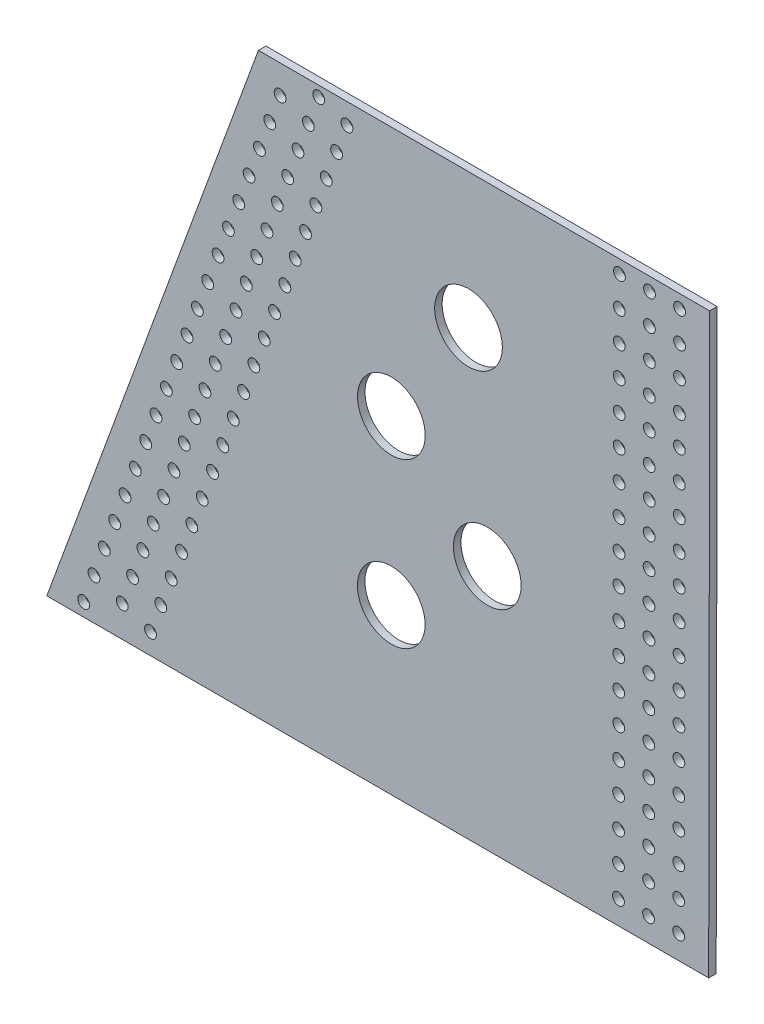
from build123d import *

# Parameters (mm, degrees)
SKETCH4_R           = 14.2875
SKETCH4_R_2         = 2.4892
SKETCH4_R_3         = 9.525
BOSS_EXTRUDE2_DEPTH = 3.175
SKETCH11_R          = 2.4892
CUT_EXTRUDE2_DEPTH  = 3.175
BOSS_EXTRUDE3_START = -3.175
SKETCH12_R          = 2.4892
SKETCH12_R_2        = 29.21
BOSS_EXTRUDE3_DEPTH = 3.175


with BuildPart() as part:
    # Sketch4 → Boss-Extrude2 (new body)
    with BuildSketch(Plane.XY):
        Polygon((93.776397203, 244.095891287), (284.276397203, 244.095891287), (283.85323076, 0), (4.45323076, 0), align=None)
        with Locations((182.46816735, 187.031911832)):
            Circle(SKETCH4_R, mode=Mode.SUBTRACT)
        with Locations((149.900784931, 138.468767486)):
            Circle(SKETCH4_R, mode=Mode.SUBTRACT)
        with Locations((134.00552713, 158.435496689)):
            Circle(SKETCH4_R_2, mode=Mode.SUBTRACT)
        with Locations((165.694943773, 118.731329743)):
            Circle(SKETCH4_R_2, mode=Mode.SUBTRACT)
        with Locations((190.39276448, 103.84941923)):
            Circle(SKETCH4_R, mode=Mode.SUBTRACT)
        with Locations((149.858385304, 69.329241783)):
            Circle(SKETCH4_R, mode=Mode.SUBTRACT)
        with Locations((197.368237983, 18.743845986)):
            Circle(SKETCH4_R_2, mode=Mode.SUBTRACT)
        with Locations((115.072237983, 40.740891242)):
            Circle(SKETCH4_R_3, mode=Mode.SUBTRACT)
        with Locations((184.668237983, 40.740891242)):
            Circle(SKETCH4_R_3, mode=Mode.SUBTRACT)
        with Locations((210.068237983, 40.740891242)):
            Circle(SKETCH4_R_2, mode=Mode.SUBTRACT)
        with Locations((171.968237983, 18.743845986)):
            Circle(SKETCH4_R_2, mode=Mode.SUBTRACT)
        with Locations((159.268237983, 40.740891242)):
            Circle(SKETCH4_R_2, mode=Mode.SUBTRACT)
        with Locations((171.968237983, 62.737936498)):
            Circle(SKETCH4_R_2, mode=Mode.SUBTRACT)
        with Locations((197.368237983, 62.737936498)):
            Circle(SKETCH4_R_2, mode=Mode.SUBTRACT)
        with Locations((140.472237983, 40.740891242)):
            Circle(SKETCH4_R_2, mode=Mode.SUBTRACT)
        with Locations((127.772237983, 18.743845986)):
            Circle(SKETCH4_R_2, mode=Mode.SUBTRACT)
        with Locations((102.372237983, 18.743845986)):
            Circle(SKETCH4_R_2, mode=Mode.SUBTRACT)
        with Locations((89.672237983, 40.740891242)):
            Circle(SKETCH4_R_2, mode=Mode.SUBTRACT)
        with Locations((102.372237983, 62.737936498)):
            Circle(SKETCH4_R_2, mode=Mode.SUBTRACT)
        with Locations((127.772237983, 62.737936498)):
            Circle(SKETCH4_R_2, mode=Mode.SUBTRACT)
    extrude(amount=BOSS_EXTRUDE2_DEPTH)

    # Sketch11 → Cut-Extrude2 (cut)
    with BuildSketch(Plane.XY.offset(3.175)):
        with Locations((271.566690721, 238.507891287)):
            Circle(SKETCH11_R)
        with Locations((258.866690721, 238.507891287)):
            Circle(SKETCH11_R)
        with Locations((246.166690721, 238.507891287)):
            Circle(SKETCH11_R)
        with Locations((258.84467394, 225.807910372)):
            Circle(SKETCH11_R)
        with Locations((246.14467394, 225.807910372)):
            Circle(SKETCH11_R)
        with Locations((258.822657159, 213.107929456)):
            Circle(SKETCH11_R)
        with Locations((246.122657159, 213.107929456)):
            Circle(SKETCH11_R)
        with Locations((258.800640378, 200.40794854)):
            Circle(SKETCH11_R)
        with Locations((246.100640378, 200.40794854)):
            Circle(SKETCH11_R)
        with Locations((258.778623597, 187.707967624)):
            Circle(SKETCH11_R)
        with Locations((246.078623597, 187.707967624)):
            Circle(SKETCH11_R)
        with Locations((258.756606817, 175.007986708)):
            Circle(SKETCH11_R)
        with Locations((246.056606817, 175.007986708)):
            Circle(SKETCH11_R)
        with Locations((258.734590036, 162.308005793)):
            Circle(SKETCH11_R)
        with Locations((246.034590036, 162.308005793)):
            Circle(SKETCH11_R)
        with Locations((258.712573255, 149.608024877)):
            Circle(SKETCH11_R)
        with Locations((246.012573255, 149.608024877)):
            Circle(SKETCH11_R)
        with Locations((258.690556474, 136.908043961)):
            Circle(SKETCH11_R)
        with Locations((245.990556474, 136.908043961)):
            Circle(SKETCH11_R)
        with Locations((258.668539693, 124.208063045)):
            Circle(SKETCH11_R)
        with Locations((245.968539693, 124.208063045)):
            Circle(SKETCH11_R)
        with Locations((258.646522912, 111.508082129)):
            Circle(SKETCH11_R)
        with Locations((245.946522912, 111.508082129)):
            Circle(SKETCH11_R)
        with Locations((258.624506131, 98.808101214)):
            Circle(SKETCH11_R)
        with Locations((245.924506131, 98.808101214)):
            Circle(SKETCH11_R)
        with Locations((258.60248935, 86.108120298)):
            Circle(SKETCH11_R)
        with Locations((245.90248935, 86.108120298)):
            Circle(SKETCH11_R)
        with Locations((258.58047257, 73.408139382)):
            Circle(SKETCH11_R)
        with Locations((245.88047257, 73.408139382)):
            Circle(SKETCH11_R)
        with Locations((258.558455789, 60.708158466)):
            Circle(SKETCH11_R)
        with Locations((245.858455789, 60.708158466)):
            Circle(SKETCH11_R)
        with Locations((258.536439008, 48.008177551)):
            Circle(SKETCH11_R)
        with Locations((245.836439008, 48.008177551)):
            Circle(SKETCH11_R)
        with Locations((258.514422227, 35.308196635)):
            Circle(SKETCH11_R)
        with Locations((245.814422227, 35.308196635)):
            Circle(SKETCH11_R)
        with Locations((258.492405446, 22.608215719)):
            Circle(SKETCH11_R)
        with Locations((245.792405446, 22.608215719)):
            Circle(SKETCH11_R)
        with Locations((258.470388665, 9.908234803)):
            Circle(SKETCH11_R)
        with Locations((245.770388665, 9.908234803)):
            Circle(SKETCH11_R)
        with Locations((271.54467394, 225.807910372)):
            Circle(SKETCH11_R)
        with Locations((271.522657159, 213.107929456)):
            Circle(SKETCH11_R)
        with Locations((271.500640378, 200.40794854)):
            Circle(SKETCH11_R)
        with Locations((271.478623597, 187.707967624)):
            Circle(SKETCH11_R)
        with Locations((271.456606817, 175.007986708)):
            Circle(SKETCH11_R)
        with Locations((271.434590036, 162.308005793)):
            Circle(SKETCH11_R)
        with Locations((271.412573255, 149.608024877)):
            Circle(SKETCH11_R)
        with Locations((271.390556474, 136.908043961)):
            Circle(SKETCH11_R)
        with Locations((271.368539693, 124.208063045)):
            Circle(SKETCH11_R)
        with Locations((271.346522912, 111.508082129)):
            Circle(SKETCH11_R)
        with Locations((271.324506131, 98.808101214)):
            Circle(SKETCH11_R)
        with Locations((271.30248935, 86.108120298)):
            Circle(SKETCH11_R)
        with Locations((271.28047257, 73.408139382)):
            Circle(SKETCH11_R)
        with Locations((271.258455789, 60.708158466)):
            Circle(SKETCH11_R)
        with Locations((271.236439008, 48.008177551)):
            Circle(SKETCH11_R)
        with Locations((271.214422227, 35.308196635)):
            Circle(SKETCH11_R)
        with Locations((271.192405446, 22.608215719)):
            Circle(SKETCH11_R)
        with Locations((271.170388665, 9.908234803)):
            Circle(SKETCH11_R)
        with Locations((102.931479448, 232.157891287)):
            Circle(SKETCH11_R)
        with Locations((114.858027617, 227.793552988)):
            Circle(SKETCH11_R)
        with Locations((126.784575785, 223.429214688)):
            Circle(SKETCH11_R)
        with Locations((110.493689317, 215.86700482)):
            Circle(SKETCH11_R)
        with Locations((122.420237485, 211.50266652)):
            Circle(SKETCH11_R)
        with Locations((106.129351017, 203.940456651)):
            Circle(SKETCH11_R)
        with Locations((118.055899186, 199.576118352)):
            Circle(SKETCH11_R)
        with Locations((101.765012718, 192.013908483)):
            Circle(SKETCH11_R)
        with Locations((113.691560886, 187.649570184)):
            Circle(SKETCH11_R)
        with Locations((97.400674418, 180.087360315)):
            Circle(SKETCH11_R)
        with Locations((109.327222586, 175.723022016)):
            Circle(SKETCH11_R)
        with Locations((93.036336119, 168.160812147)):
            Circle(SKETCH11_R)
        with Locations((104.962884287, 163.796473848)):
            Circle(SKETCH11_R)
        with Locations((88.671997819, 156.234263979)):
            Circle(SKETCH11_R)
        with Locations((100.598545987, 151.869925679)):
            Circle(SKETCH11_R)
        with Locations((84.30765952, 144.307715811)):
            Circle(SKETCH11_R)
        with Locations((96.234207688, 139.943377511)):
            Circle(SKETCH11_R)
        with Locations((79.94332122, 132.381167643)):
            Circle(SKETCH11_R)
        with Locations((91.869869388, 128.016829343)):
            Circle(SKETCH11_R)
        with Locations((75.57898292, 120.454619475)):
            Circle(SKETCH11_R)
        with Locations((87.505531089, 116.090281175)):
            Circle(SKETCH11_R)
        with Locations((71.214644621, 108.528071306)):
            Circle(SKETCH11_R)
        with Locations((83.141192789, 104.163733007)):
            Circle(SKETCH11_R)
        with Locations((66.850306321, 96.601523138)):
            Circle(SKETCH11_R)
        with Locations((78.776854489, 92.237184839)):
            Circle(SKETCH11_R)
        with Locations((62.485968022, 84.67497497)):
            Circle(SKETCH11_R)
        with Locations((74.41251619, 80.310636671)):
            Circle(SKETCH11_R)
        with Locations((58.121629722, 72.748426802)):
            Circle(SKETCH11_R)
        with Locations((70.04817789, 68.384088502)):
            Circle(SKETCH11_R)
        with Locations((53.757291423, 60.821878634)):
            Circle(SKETCH11_R)
        with Locations((65.683839591, 56.457540334)):
            Circle(SKETCH11_R)
        with Locations((49.392953123, 48.895330466)):
            Circle(SKETCH11_R)
        with Locations((61.319501291, 44.530992166)):
            Circle(SKETCH11_R)
        with Locations((45.028614823, 36.968782298)):
            Circle(SKETCH11_R)
        with Locations((56.955162992, 32.604443998)):
            Circle(SKETCH11_R)
        with Locations((40.664276524, 25.042234129)):
            Circle(SKETCH11_R)
        with Locations((52.590824692, 20.67789583)):
            Circle(SKETCH11_R)
        with Locations((36.299938224, 13.115685961)):
            Circle(SKETCH11_R)
        with Locations((48.226486392, 8.751347662)):
            Circle(SKETCH11_R)
        with Locations((98.567141149, 220.231343119)):
            Circle(SKETCH11_R)
        with Locations((94.202802849, 208.304794951)):
            Circle(SKETCH11_R)
        with Locations((89.83846455, 196.378246783)):
            Circle(SKETCH11_R)
        with Locations((85.47412625, 184.451698615)):
            Circle(SKETCH11_R)
        with Locations((81.109787951, 172.525150447)):
            Circle(SKETCH11_R)
        with Locations((76.745449651, 160.598602279)):
            Circle(SKETCH11_R)
        with Locations((72.381111351, 148.67205411)):
            Circle(SKETCH11_R)
        with Locations((68.016773052, 136.745505942)):
            Circle(SKETCH11_R)
        with Locations((63.652434752, 124.818957774)):
            Circle(SKETCH11_R)
        with Locations((59.288096453, 112.892409606)):
            Circle(SKETCH11_R)
        with Locations((54.923758153, 100.965861438)):
            Circle(SKETCH11_R)
        with Locations((50.559419854, 89.03931327)):
            Circle(SKETCH11_R)
        with Locations((46.195081554, 77.112765102)):
            Circle(SKETCH11_R)
        with Locations((41.830743254, 65.186216933)):
            Circle(SKETCH11_R)
        with Locations((37.466404955, 53.259668765)):
            Circle(SKETCH11_R)
        with Locations((33.102066655, 41.333120597)):
            Circle(SKETCH11_R)
        with Locations((28.737728356, 29.406572429)):
            Circle(SKETCH11_R)
        with Locations((24.373390056, 17.480024261)):
            Circle(SKETCH11_R)
        with Locations((20.009051757, 5.553476093)):
            Circle(SKETCH11_R)
        with Locations((119.222365916, 239.720101156)):
            Circle(SKETCH11_R)
        with Locations((131.148914084, 235.355762856)):
            Circle(SKETCH11_R)
    extrude(amount=-CUT_EXTRUDE2_DEPTH, mode=Mode.SUBTRACT)

    # Sketch12 → Boss-Extrude3 (add)
    with BuildSketch(Plane.XY.offset(3.175).offset(BOSS_EXTRUDE3_START)):
        with Locations((134.00552713, 158.435496689)):
            Circle(SKETCH12_R)
        with Locations((165.694943773, 118.731329743)):
            Circle(SKETCH12_R)
        with Locations((184.668237983, 40.740891242)):
            Circle(SKETCH12_R_2)
        with Locations((115.072237983, 40.740891242)):
            Circle(SKETCH12_R_2)
    extrude(amount=BOSS_EXTRUDE3_DEPTH)


solid = part.part
